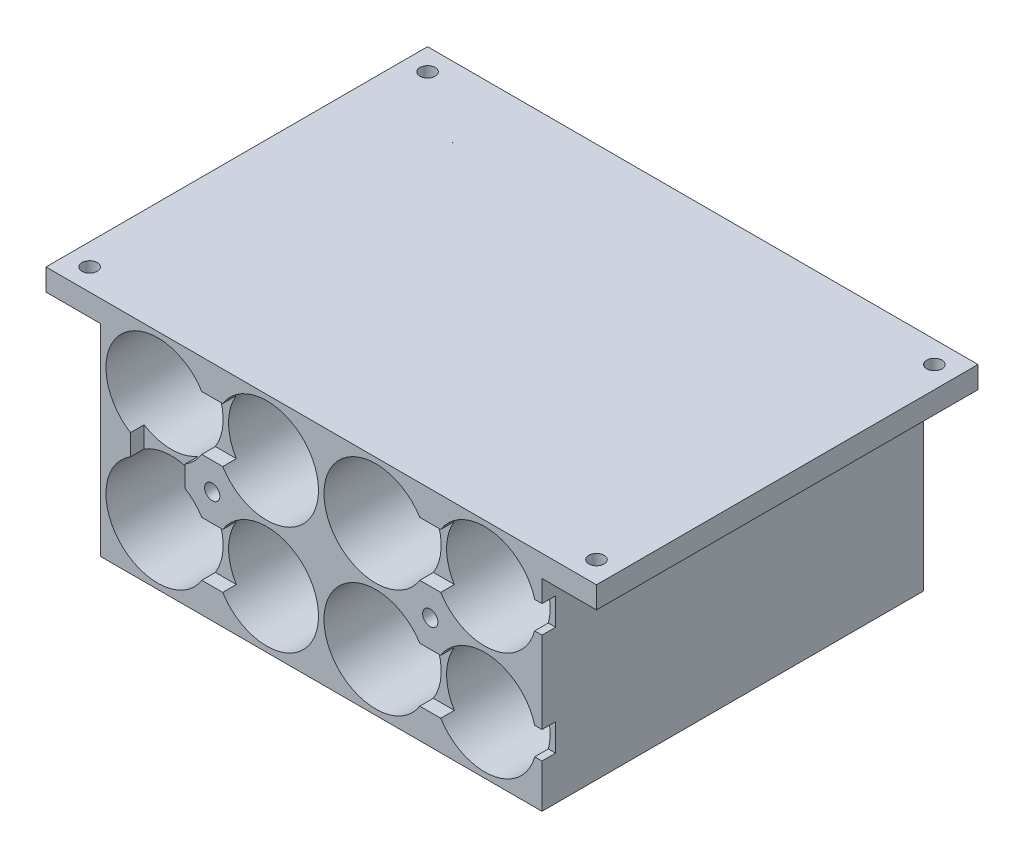
from build123d import *

# Parameters (mm, degrees)
SKETCH1_W           = 81
SKETCH1_H           = 41
BOSS_EXTRUDE1_DEPTH = 70
SKETCH2_R           = 9.5
CUT_EXTRUDE1_DEPTH  = 115.638562447
SKETCH3_W           = 70
SKETCH3_H           = 4
BOSS_EXTRUDE2_DEPTH = 10
SKETCH4_W           = 70
SKETCH4_H           = 4
BOSS_EXTRUDE3_DEPTH = 10
SKETCH5_R           = 1.4
CUT_EXTRUDE2_DEPTH  = 122.909802723
SKETCH6_W           = 10
SKETCH6_H           = 10
CUT_EXTRUDE3_DEPTH  = 2.5
SKETCH7_W           = 10
SKETCH7_H           = 10
CUT_EXTRUDE4_DEPTH  = 2.5
SKETCH8_W           = 10
SKETCH8_H           = 10
CUT_EXTRUDE5_DEPTH  = 2.5
SKETCH9_W           = 10
SKETCH9_H           = 10
SKETCH9_H_2         = 5
CUT_EXTRUDE6_DEPTH  = 2.5
SKETCH10_R          = 1.4
CUT_EXTRUDE7_DEPTH  = 122.909802723


with BuildPart() as part:
    # Sketch1 → Boss-Extrude1 (new body)
    with BuildSketch(Plane.XY):
        with Locations((40.5, 20.5)):
            Rectangle(SKETCH1_W, SKETCH1_H)
    extrude(amount=BOSS_EXTRUDE1_DEPTH)

    # Sketch2 → Cut-Extrude1 (cut, through all)
    with BuildSketch(Plane.XY.offset(70)):
        with Locations((10.5, 30.5)):
            Circle(SKETCH2_R)
        with Locations((30.5, 30.5)):
            Circle(SKETCH2_R)
        with Locations((50.5, 30.5)):
            Circle(SKETCH2_R)
        with Locations((70.5, 30.5)):
            Circle(SKETCH2_R)
        with Locations((30.5, 10.5)):
            Circle(SKETCH2_R)
        with Locations((50.5, 10.5)):
            Circle(SKETCH2_R)
        with Locations((70.5, 10.5)):
            Circle(SKETCH2_R)
        with Locations((10.5, 10.5)):
            Circle(SKETCH2_R)
    extrude(amount=-CUT_EXTRUDE1_DEPTH, mode=Mode.SUBTRACT)

    # Sketch3 → Boss-Extrude2 (add)
    with BuildSketch(Plane.ZY):
        with Locations((35, 39)):
            Rectangle(SKETCH3_W, SKETCH3_H)
    extrude(amount=BOSS_EXTRUDE2_DEPTH)

    # Sketch4 → Boss-Extrude3 (add)
    with BuildSketch(Plane(origin=(81, 0, 0), x_dir=(0, 0, -1), z_dir=(1, 0, 0))):
        with Locations((-35, 39)):
            Rectangle(SKETCH4_W, SKETCH4_H)
    extrude(amount=BOSS_EXTRUDE3_DEPTH)

    # Sketch5 → Cut-Extrude2 (cut, through all)
    with BuildSketch(Plane(origin=(0, 41, 0), x_dir=(1, 0, 0), z_dir=(0, 1, 0))):
        with Locations(Location((-6, -4, 0), (0, 0, 270))):
            Circle(SKETCH5_R)
        with Locations(Location((-6, -66, 0), (0, 0, 270))):
            Circle(SKETCH5_R)
        with Locations(Location((87, -66, 0), (0, 0, 270))):
            Circle(SKETCH5_R)
        with Locations(Location((87, -4, 0), (0, 0, 270))):
            Circle(SKETCH5_R)
    extrude(amount=-CUT_EXTRUDE2_DEPTH, mode=Mode.SUBTRACT)

    # Sketch6 → Cut-Extrude3 (cut)
    with BuildSketch(Plane.XY.offset(70)):
        with Locations((20.424528373, 30.5)):
            Rectangle(SKETCH6_W, SKETCH6_H)
        with Locations((59.858568815, 30.5)):
            Rectangle(SKETCH6_W, SKETCH6_H)
        with Locations((20.424528373, 10.5)):
            Rectangle(SKETCH6_W, SKETCH6_H)
        with Locations((59.858568815, 10.5)):
            Rectangle(SKETCH6_W, SKETCH6_H)
    extrude(amount=-CUT_EXTRUDE3_DEPTH, mode=Mode.SUBTRACT)

    # Sketch7 → Cut-Extrude4 (cut)
    with BuildSketch(Plane(origin=(0, 0, 0), x_dir=(-1, 0, 0), z_dir=(0, 0, -1))):
        with Locations((-61, 30.5)):
            Rectangle(SKETCH7_W, SKETCH7_H)
        with Locations((-20, 30.5)):
            Rectangle(SKETCH7_W, SKETCH7_H)
        with Locations((-20, 10.5)):
            Rectangle(SKETCH7_W, SKETCH7_H)
        with Locations((-61, 10.5)):
            Rectangle(SKETCH7_W, SKETCH7_H)
    extrude(amount=-CUT_EXTRUDE4_DEPTH, mode=Mode.SUBTRACT)

    # Sketch8 → Cut-Extrude5 (cut)
    with BuildSketch(Plane(origin=(0, 0, 0), x_dir=(-1, 0, 0), z_dir=(0, 0, -1))):
        with Locations((-40, 30.5)):
            Rectangle(SKETCH8_W, SKETCH8_H)
        with Locations((-40, 10.5)):
            Rectangle(SKETCH8_W, SKETCH8_H)
    extrude(amount=-CUT_EXTRUDE5_DEPTH, mode=Mode.SUBTRACT)

    # Sketch9 → Cut-Extrude6 (cut)
    with BuildSketch(Plane.XY.offset(70)):
        with Locations((10.5, 20.5)):
            Rectangle(SKETCH9_W, SKETCH9_H)
        with Locations((79, 30.5)):
            Rectangle(SKETCH9_W, SKETCH9_H_2)
        with Locations((79, 10.5)):
            Rectangle(SKETCH9_W, SKETCH9_H_2)
    extrude(amount=-CUT_EXTRUDE6_DEPTH, mode=Mode.SUBTRACT)

    # Sketch10 → Cut-Extrude7 (cut, through all)
    with BuildSketch(Plane.XY.offset(70)):
        with Locations((20.5, 20.5)):
            Circle(SKETCH10_R)
        with Locations((60.5, 20.5)):
            Circle(SKETCH10_R)
    extrude(amount=-CUT_EXTRUDE7_DEPTH, mode=Mode.SUBTRACT)


solid = part.part
